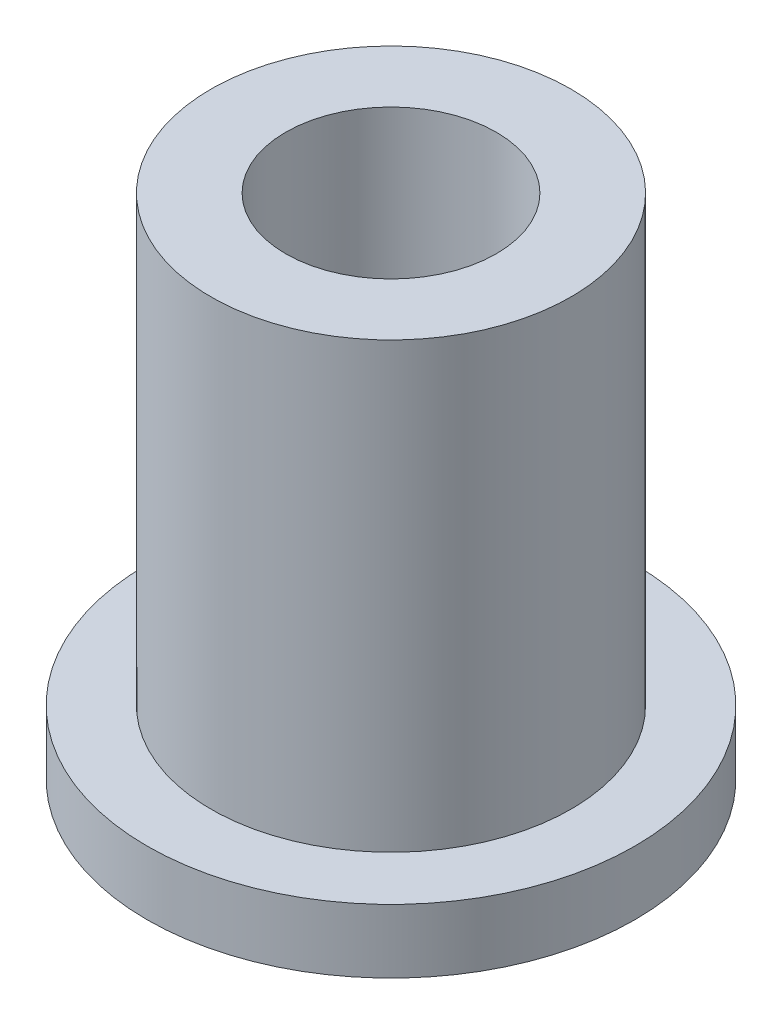
from build123d import *

# Parameters (mm, degrees)
M4X0_7_TAPPED_HOLE1_D = 3.3


with BuildPart() as part:
    # Sketch1 → Revolve1 (revolve)
    with BuildSketch(Plane(origin=(0, 0, 0), x_dir=(0, 0, -1), z_dir=(1, 0, 0))):
        Polygon((0, 0), (3.82, 0), (3.82, 1), (2.82, 1), (2.82, 7.95), (0, 7.95), align=None)
    revolve(axis=Axis((0, 0, 0), (0, 1, 0)))

    # M4x0.7 Tapped Hole1 (through all)
    with Locations(Plane(origin=(0, 0, 0), x_dir=(0, 0, -1), z_dir=(0, -1, 0))):
        with Locations((0, 0)):
            Hole(M4X0_7_TAPPED_HOLE1_D / 2)


solid = part.part
